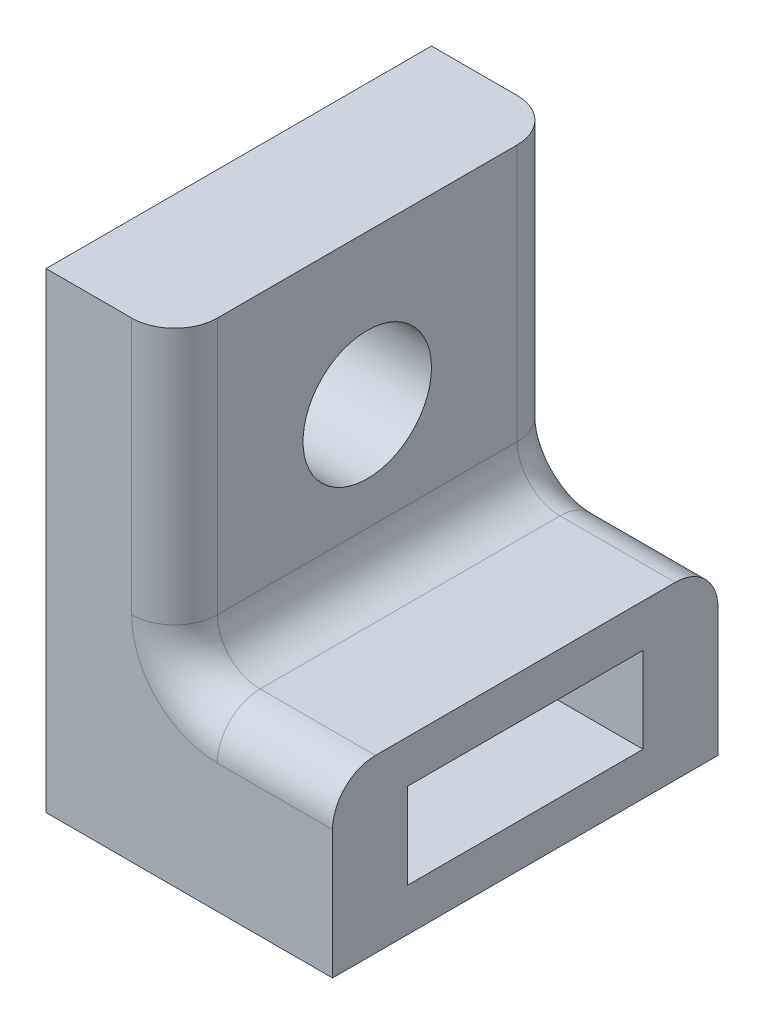
from build123d import *
from build123d.topology import SkipClean

# Parameters (mm, degrees)
CUT_EXTRUDE1_DEPTH       = 10
CUT_EXTRUDE1_DEPTH_BACK  = 10
SKETCH2_R                = 1.5
BOSS_EXTRUDE1_DEPTH      = 2
BOSS_EXTRUDE1_DEPTH_BACK = 2
SKETCH4_W                = 33
SKETCH4_H                = 9
CUT_EXTRUDE2_DEPTH       = 1.5
CUT_EXTRUDE2_DEPTH_BACK  = 10
SKETCH5_R                = 1.5
CUT_EXTRUDE3_DEPTH       = 10
CUT_EXTRUDE3_DEPTH_BACK  = 10
SKETCH8_R                = 1.5
SKETCH9_W                = 8.987494889
SKETCH9_H                = 0.781338227
SKETCH9_H_2              = 1.225544695
CUT_EXTRUDE4_DEPTH       = 46
SKETCH10_W               = 5.5
SKETCH10_H               = 2
CUT_EXTRUDE5_DEPTH       = 30
SKETCH11_W               = 3
SKETCH11_H               = 9
BOSS_EXTRUDE2_DEPTH      = 7
SKETCH12_R               = 1.5
CUT_EXTRUDE6_DEPTH       = 7
FILLET1_R                = 1
FILLET2_R                = 1
FILLET3_R                = 1
FILLET4_R                = 1
SKETCH13_W               = 28.065917506
SKETCH13_H               = 13.293965236
CUT_EXTRUDE7_DEPTH       = 10


with BuildPart() as part:
    # Sketch1 → Revolve1 (revolve)
    with BuildSketch(Plane.XY):
        with BuildLine():
            Line((0, 0), (-6, 0))
            ThreePointArc((-6, 0), (-3, 3), (0, 0))
        make_face()
    revolve(axis=Axis((0, 0, 0), (-1, 0, 0)))

    # Sketch2 → Cut-Extrude1 (cut, two sides: drawn at the far end of the back side and taken through both)
    with BuildSketch(Plane(origin=(0, 0, 0), x_dir=(1, 0, 0), z_dir=(0, 1, 0)).offset(-CUT_EXTRUDE1_DEPTH_BACK)):
        with Locations((-3, 0)):
            Circle(SKETCH2_R)
    extrude(amount=CUT_EXTRUDE1_DEPTH + CUT_EXTRUDE1_DEPTH_BACK, mode=Mode.SUBTRACT)

    # Sketch4 → Boss-Extrude1 (add, two sides: drawn at the far end of the back side and taken through both)
    with SkipClean():  # the faces are left unmerged after this step: merging them gives an invalid solid
        with BuildSketch(Plane(origin=(0, 0, 0), x_dir=(1, 0, 0), z_dir=(0, 1, 0)).offset(-BOSS_EXTRUDE1_DEPTH_BACK)):
            with Locations((-14, 0)):
                Rectangle(SKETCH4_W, SKETCH4_H)
        extrude(amount=BOSS_EXTRUDE1_DEPTH + BOSS_EXTRUDE1_DEPTH_BACK)

    # Sketch5 → Cut-Extrude2 (cut, two sides: drawn at the far end of the back side and taken through both)
    with SkipClean():  # the faces are left unmerged after this step: merging them gives an invalid solid
        with BuildSketch(Plane(origin=(0, 2, 0), x_dir=(1, 0, 0), z_dir=(0, 1, 0)).offset(-CUT_EXTRUDE2_DEPTH_BACK)):
            with Locations((-3, 0)):
                Circle(SKETCH5_R)
        extrude(amount=CUT_EXTRUDE2_DEPTH + CUT_EXTRUDE2_DEPTH_BACK, mode=Mode.SUBTRACT)

    # Sketch6 → Cut-Revolve1 (revolve, cut)
    with BuildSketch(Plane(origin=(0, 0, 0), x_dir=(1, 0, 0), z_dir=(0, 1, 0))):
        with BuildLine():
            Line((-3, 3.5), (-3, -3.5))
            ThreePointArc((-3, -3.5), (-6.5, 0), (-3, 3.5))
        make_face()
    revolve(axis=Axis((-3, 0, -3.5), (0, 0, 1)), mode=Mode.SUBTRACT)

    # Sketch10 → Cut-Extrude5 (cut)
    with BuildSketch(Plane.ZY.offset(30.5)):
        Rectangle(SKETCH10_W, SKETCH10_H)
    extrude(amount=-CUT_EXTRUDE5_DEPTH, mode=Mode.SUBTRACT)

    # Sketch11 → Boss-Extrude2 (add)
    with BuildSketch(Plane(origin=(0, 2, 0), x_dir=(1, 0, 0), z_dir=(0, 1, 0))):
        with Locations((-29, 0)):
            Rectangle(SKETCH11_W, SKETCH11_H)
    extrude(amount=BOSS_EXTRUDE2_DEPTH)

    # Sketch12 → Cut-Extrude6 (cut)
    with BuildSketch(Plane(origin=(-27.5, 0, 0), x_dir=(0, 0, -1), z_dir=(1, 0, 0))):
        with Locations((0, 5.5)):
            Circle(SKETCH12_R)
    extrude(amount=-CUT_EXTRUDE6_DEPTH, mode=Mode.SUBTRACT)

    # Fillet1
    fillet1_edges = [part.edges().sort_by_distance(p)[0] for p in [
        (2.5, 0, -4.5),
    ]]
    fillet(fillet1_edges, radius=FILLET1_R)

    # Fillet2
    fillet2_edges = [part.edges().sort_by_distance(p)[0] for p in [
        (2.5, 0, 4.5),
    ]]
    fillet(fillet2_edges, radius=FILLET2_R)

    # Fillet3
    fillet3_edges = [part.edges().sort_by_distance(p)[0] for p in [
        (-27.5, 2, 0),
    ]]
    fillet(fillet3_edges, radius=FILLET3_R)

    # Fillet4
    fillet4_edges = [part.edges().sort_by_distance(p)[0] for p in [
        (-27.5, 6, 4.5),
        (-27.207106781, 2.292893219, 4.5),
        (-12.5, 2, 4.5),
        (2.207106781, 2, 4.207106781),
        (2.5, 2, 0),
        (2.207106781, 2, -4.207106781),
        (-27.5, 6, -4.5),
        (-27.207106781, 2.292893219, -4.5),
        (-12.5, 2, -4.5),
    ]]
    fillet(fillet4_edges, radius=FILLET4_R)


with BuildPart() as body_2:
    # Sketch7 → Revolve2 (revolve)
    with BuildSketch(Plane(origin=(0, 0, 0), x_dir=(1, 0, 0), z_dir=(0, 1, 0))):
        with BuildLine():
            Line((-3, 3), (-3, -3))
            ThreePointArc((-3, -3), (-6, 0), (-3, 3))
        make_face()
    revolve(axis=Axis((-3, 0, -3), (0, 0, 1)))

    # Sketch8 → Cut-Extrude3 (cut, two sides: drawn at the far end of the back side and taken through both)
    with BuildSketch(Plane(origin=(0, 0, 0), x_dir=(1, 0, 0), z_dir=(0, 1, 0)).offset(-CUT_EXTRUDE3_DEPTH_BACK)):
        with Locations((-3, 0)):
            Circle(SKETCH8_R)
    extrude(amount=CUT_EXTRUDE3_DEPTH + CUT_EXTRUDE3_DEPTH_BACK, mode=Mode.SUBTRACT)

    # Sketch9 → Cut-Extrude4 (cut)
    with BuildSketch(Plane.ZY.offset(30.5)):
        with Locations((-0.006252555, 2.390669113)):
            Rectangle(SKETCH9_W, SKETCH9_H)
        with Locations((-0.006252555, -2.612772347)):
            Rectangle(SKETCH9_W, SKETCH9_H_2)
    extrude(amount=-CUT_EXTRUDE4_DEPTH, mode=Mode.SUBTRACT)


with BuildPart() as cut_extrude7_tool:
    # Sketch13 → Cut-Extrude7 (new body)
    with BuildSketch(Plane(origin=(0, 2, 0), x_dir=(1, 0, 0), z_dir=(0, 1, 0))):
        with Locations((-9.778349348, -0.92291484)):
            Rectangle(SKETCH13_W, SKETCH13_H)
    extrude(amount=-CUT_EXTRUDE7_DEPTH)


with BuildPart() as part_1:
    add(part.part)

    # Cut-Extrude7: cut by cut_extrude7_tool
    add(cut_extrude7_tool.part, mode=Mode.SUBTRACT)


with BuildPart() as body_2_1:
    add(body_2.part)

    # Cut-Extrude7: cut by cut_extrude7_tool
    add(cut_extrude7_tool.part, mode=Mode.SUBTRACT)


solid = part_1.part
